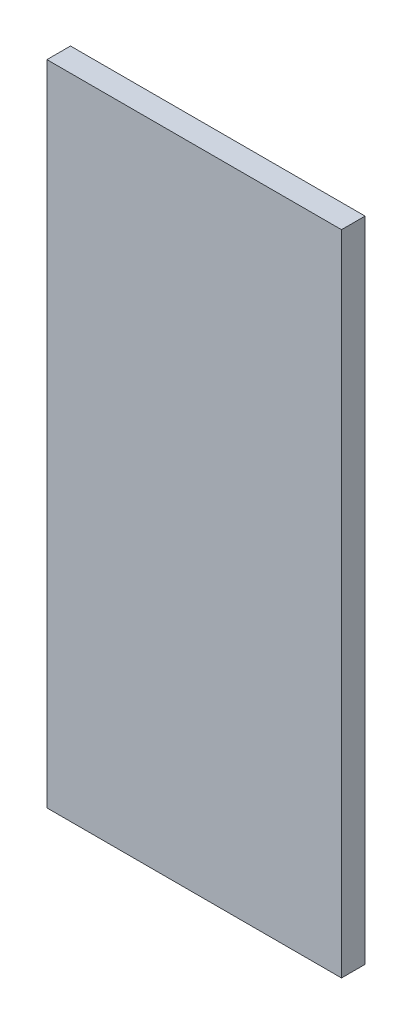
from build123d import *

# Parameters (mm, degrees)
SKETCH2_W           = 25
SKETCH2_H           = 55
BOSS_EXTRUDE1_DEPTH = 2


with BuildPart() as part:
    # Sketch2 → Boss-Extrude1 (new body)
    with BuildSketch(Plane.XY):
        Rectangle(SKETCH2_W, SKETCH2_H)
    extrude(amount=BOSS_EXTRUDE1_DEPTH)


solid = part.part
